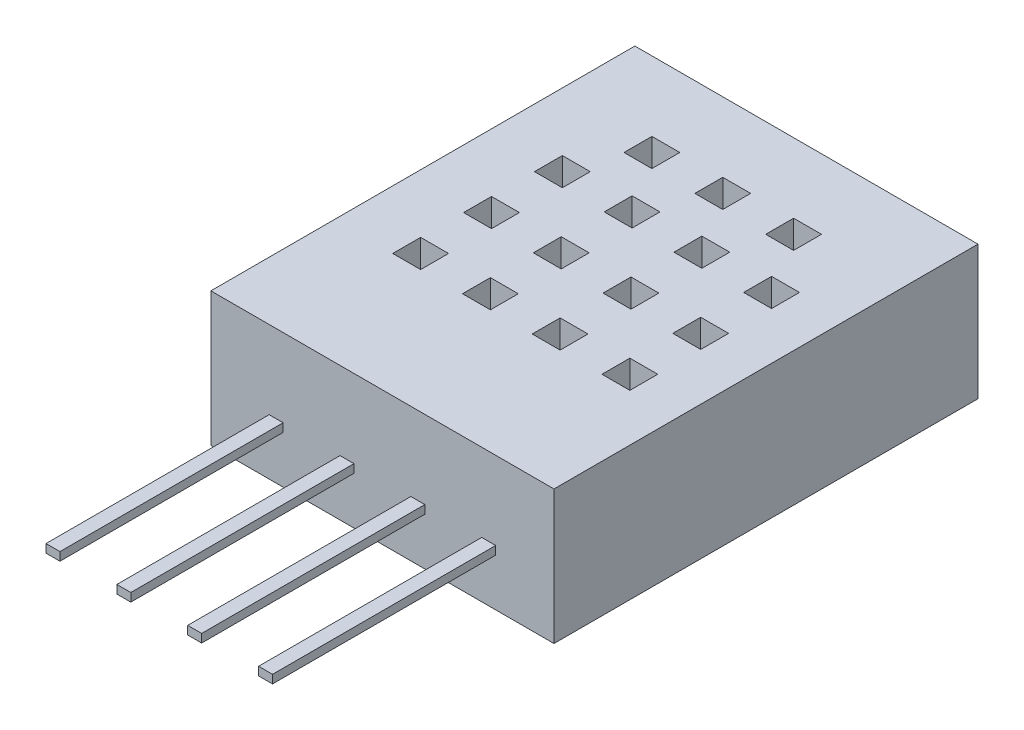
from build123d import *

# Parameters (mm, degrees)
SKETCH_1_W                  = 12.3
SKETCH_1_H                  = 15.2
EXTRUDE_1_DEPTH             = 4.8
SKETCH_2_W                  = 0.5
SKETCH_2_H                  = 0.3
EXTRUDE_2_DEPTH             = 8
PATTERN_LINEAR_1_COUNT      = 4
PATTERN_LINEAR_1_PITCH      = 2.54
SKETCH_3_W                  = 1
SKETCH_3_H                  = 1
CUT_EXTRUDE_1_DEPTH         = 2
PATTERN_LINEAR_2_COUNT      = 2
PATTERN_LINEAR_2_PITCH      = 2.54
PATTERN_LINEAR_2_COL_COUNT  = 2
PATTERN_LINEAR_2_COL_PITCH  = 2.54
SKETCH_4_W                  = 1
SKETCH_4_H                  = 1
CUT_EXTRUDE_2_DEPTH         = 2
PATTERN_LINEAR_3_COUNT      = 4
PATTERN_LINEAR_3_PITCH      = 2.5
PATTERN_LINEAR_3_COUNT_DIR2 = 3
PATTERN_LINEAR_3_PITCH_DIR2 = 2.54


with BuildPart() as part:
    # Эскиз1 → Бобышка-Вытянуть1 (new body)
    with BuildSketch(Plane(origin=(0, 0, 0), x_dir=(1, 0, 0), z_dir=(0, 1, 0))):
        Rectangle(SKETCH_1_W, SKETCH_1_H)
    extrude(amount=EXTRUDE_1_DEPTH)

    # Эскиз3 → Вырез-Вытянуть1 (cut)
    with BuildSketch(Plane(origin=(0, 4.8, 0), x_dir=(1, 0, 0), z_dir=(0, 1, 0))):
        with Locations((0, 4.6)):
            Rectangle(SKETCH_3_W, SKETCH_3_H)
    cut_extrude_1 = extrude(amount=-CUT_EXTRUDE_1_DEPTH, mode=Mode.SUBTRACT)

    # Линейный массив2: Вырез-Вытянуть1 ×2
    with Locations(*[(i * PATTERN_LINEAR_2_PITCH, 0, 0) for i in range(1, PATTERN_LINEAR_2_COUNT)]):
        add(cut_extrude_1, mode=Mode.SUBTRACT)

    # Линейный массив2 col: Вырез-Вытянуть1 ×2
    with Locations(*[(-i * PATTERN_LINEAR_2_COL_PITCH, 0, 0) for i in range(1, PATTERN_LINEAR_2_COL_COUNT)]):
        add(cut_extrude_1, mode=Mode.SUBTRACT)

    # Эскиз4 → Вырез-Вытянуть2 (cut)
    with BuildSketch(Plane(origin=(0, 4.8, 0), x_dir=(1, 0, 0), z_dir=(0, 1, 0))):
        with Locations((3.95, 2.4)):
            Rectangle(SKETCH_4_W, SKETCH_4_H)
    cut_extrude_2 = extrude(amount=-CUT_EXTRUDE_2_DEPTH, mode=Mode.SUBTRACT)

    # Линейный массив3: Cut-Extrude 2 4 × 3
    with Locations(*[(-i * PATTERN_LINEAR_3_PITCH, 0, j * PATTERN_LINEAR_3_PITCH_DIR2) for i in range(PATTERN_LINEAR_3_COUNT) for j in range(PATTERN_LINEAR_3_COUNT_DIR2) if (i, j) != (0, 0)]):
        add(cut_extrude_2, mode=Mode.SUBTRACT)


with BuildPart() as body_2:
    # Эскиз2 → Бобышка-Вытянуть2 (new body)
    with BuildSketch(Plane.XY.offset(7.6)):
        with Locations((3.81, 1.85)):
            Rectangle(SKETCH_2_W, SKETCH_2_H)
    extrude(amount=EXTRUDE_2_DEPTH)


with BuildPart() as pattern_linear_1_1:
    # Линейный массив1: pattern copy
    add(body_2.part.moved(Location(Vector(-1, 0, 0) * (1 * PATTERN_LINEAR_1_PITCH))))


with BuildPart() as pattern_linear_1_2:
    # Линейный массив1: pattern copy
    add(body_2.part.moved(Location(Vector(-1, 0, 0) * (2 * PATTERN_LINEAR_1_PITCH))))


with BuildPart() as pattern_linear_1_3:
    # Линейный массив1: pattern copy
    add(body_2.part.moved(Location(Vector(-1, 0, 0) * (3 * PATTERN_LINEAR_1_PITCH))))


solid = Compound([part.part, body_2.part, pattern_linear_1_1.part, pattern_linear_1_2.part, pattern_linear_1_3.part])
